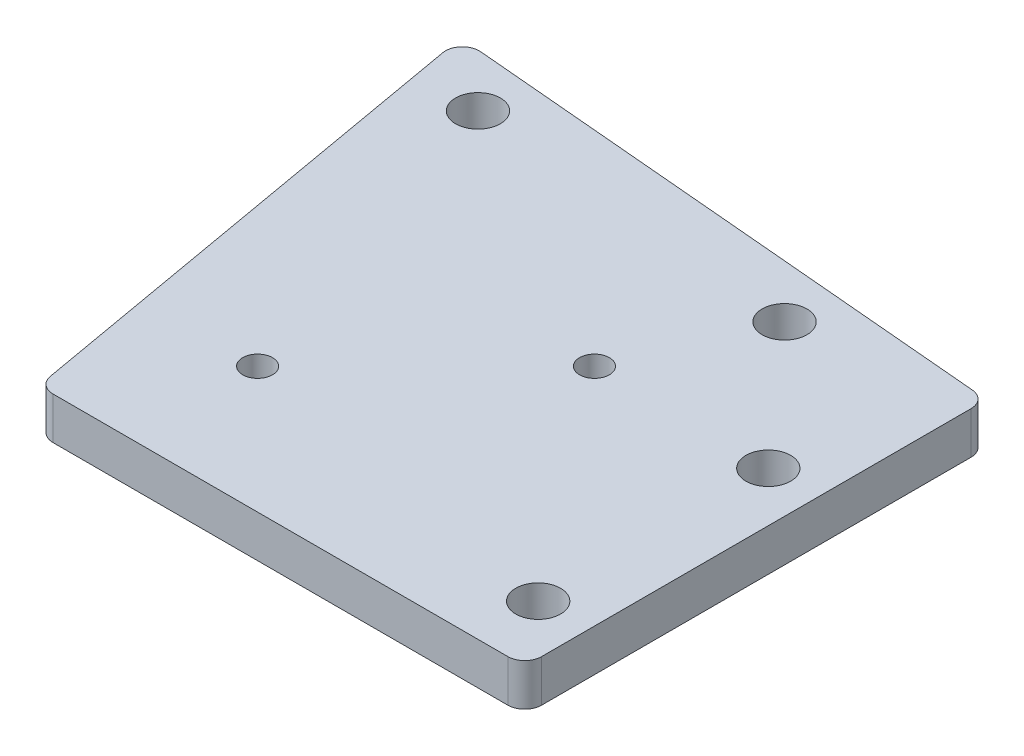
from build123d import *

# Parameters (mm, degrees)
BOSS_EXTRUDE1_DEPTH     = 6.35
F_1_4_CLEARANCE_HOLE1_D = 6.7564
F_8_CLEARANCE_HOLE1_D   = 4.4958
FILLET1_R               = 2.54


with BuildPart() as part:
    # Sketch1 → Boss-Extrude1 (new body)
    with BuildSketch(Plane(origin=(0, 0, 0), x_dir=(1, 0, 0), z_dir=(0, 1, 0))):
        Polygon((46.634796, -31.75), (46.634796, 22.824939239), (46.634796, 37.882236802), (-40.259946838, 45.48454172), (-26.64141329, -31.75), align=None)
    extrude(amount=-BOSS_EXTRUDE1_DEPTH)

    # 1/4 Clearance Hole1 (through all)
    with Locations(Plane(origin=(0, -6.35, 0), x_dir=(-1, 0, 0), z_dir=(0, -1, 0))):
        with Locations((-21.234796, 32.832322476), (-39.1347856, -22.225), (-39.1347856, 12.482236802), (29.432583699, 37.26514381)):
            Hole(F_1_4_CLEARANCE_HOLE1_D / 2)

    # #8 Clearance Hole1 (through all)
    with Locations(Plane(origin=(0, 0, 0), x_dir=(1, 0, 0), z_dir=(0, 1, 0))):
        with Locations((12.698082155, 12.698082155), (-12.698082155, -12.698082155)):
            Hole(F_8_CLEARANCE_HOLE1_D / 2)

    # Fillet1
    fillet1_edges = [part.edges().sort_by_distance(p)[0] for p in [
        (-40.259946838, -3.175, -45.48454172),
        (46.634796, -3.175, -37.882236802),
        (-26.64141329, -3.175, 31.75),
        (46.634796, -3.175, 31.75),
    ]]
    fillet(fillet1_edges, radius=FILLET1_R)


solid = part.part
